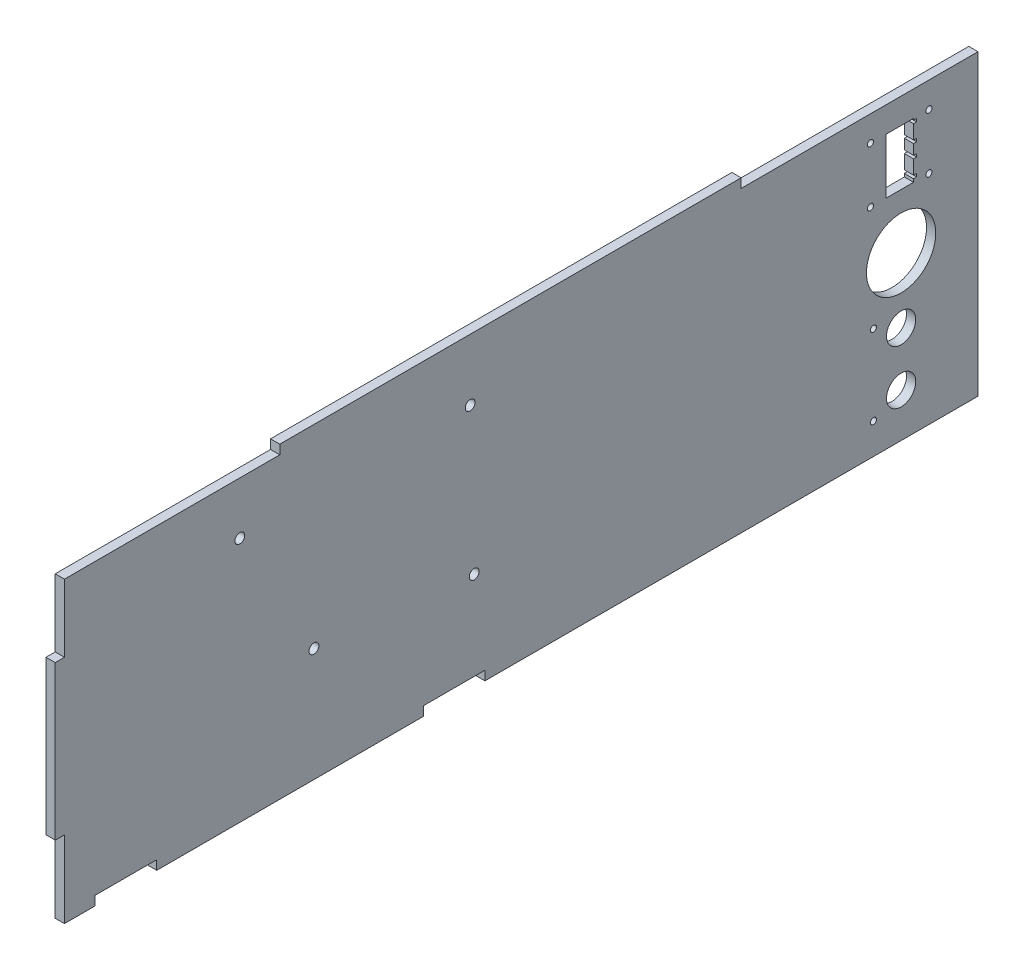
from build123d import *

# Parameters (mm, degrees)
ESQUISSE1_R        = 1
ESQUISSE1_R_2      = 4.75
ESQUISSE1_R_3      = 1.6
ESQUISSE1_R_4      = 11.265
BOSS_EXTRU_1_DEPTH = 3


with BuildPart() as part:
    # Esquisse1 → Boss.-Extru.1 (new body)
    with BuildSketch(Plane(origin=(3, 0, 0), x_dir=(0, 0, -1), z_dir=(1, 0, 0))):
        Polygon((-199.626758929, -26.84585796), (-189.626758929, -26.84585796), (-189.626758929, -23.84585796), (-169.626758929, -23.84585796), (-169.626758929, -26.84585796), (-82.926758929, -26.84585796), (-82.926758929, -23.84585796), (-62.926758929, -23.84585796), (-62.926758929, -26.84585796), (97.373241071, -26.84585796), (97.373241071, 70.15414204), (20.373241071, 70.15414204), (20.373241071, 73.15414204), (-129.626758929, 73.15414204), (-129.626758929, 70.15414204), (-199.626758929, 70.15414204), (-199.626758929, 48.15414204), (-202.626758929, 48.15414204), (-202.626758929, -1.84585796), (-199.626758929, -1.84585796), align=None)
        with Locations(Location((63.373241071, -16.84585796, 0), (0, 0, 180))):
            Circle(ESQUISSE1_R, mode=Mode.SUBTRACT)
        with Locations(Location((72.373241071, 4.90414204, 0), (0, 0, 180))):
            Circle(ESQUISSE1_R_2, mode=Mode.SUBTRACT)
        with Locations(Location((-67.726758929, 53.15414204, 0), (0, 0, 180))):
            Circle(ESQUISSE1_R_3, mode=Mode.SUBTRACT)
        with Locations(Location((-118.526758929, 10.05414204, 0), (0, 0, 180))):
            Circle(ESQUISSE1_R_3, mode=Mode.SUBTRACT)
        with Locations(Location((-142.626758929, 53.15414204, 0), (0, 0, 180))):
            Circle(ESQUISSE1_R_3, mode=Mode.SUBTRACT)
        with Locations(Location((-66.426758929, 4.95414204, 0), (0, 0, 180))):
            Circle(ESQUISSE1_R_3, mode=Mode.SUBTRACT)
        with Locations(Location((72.373241071, -12.59585796, 0), (0, 0, 180))):
            Circle(ESQUISSE1_R_2, mode=Mode.SUBTRACT)
        with Locations(Location((63.373241071, 9.15414204, 0), (0, 0, 180))):
            Circle(ESQUISSE1_R, mode=Mode.SUBTRACT)
        with Locations(Location((62.423241071, 43.85414204, 0), (0, 0, 180))):
            Circle(ESQUISSE1_R, mode=Mode.SUBTRACT)
        with Locations(Location((62.423241071, 61.85414204, 0), (0, 0, 180))):
            Circle(ESQUISSE1_R, mode=Mode.SUBTRACT)
        with Locations((72.373241071, 25.996622543)):
            Circle(ESQUISSE1_R_4, mode=Mode.SUBTRACT)
        with Locations(Location((81.423241071, 43.85414204, 0), (0, 0, 180))):
            Circle(ESQUISSE1_R, mode=Mode.SUBTRACT)
        with Locations(Location((81.423241071, 61.85414204, 0), (0, 0, 180))):
            Circle(ESQUISSE1_R, mode=Mode.SUBTRACT)
        Polygon((77.423241071, 44.85414204), (76.423241071, 44.85414204), (76.423241071, 43.85414204), (67.423241071, 43.85414204), (67.423241071, 61.85414204), (76.423241071, 61.85414204), (76.423241071, 61.35414204), (77.423241071, 61.35414204), (77.423241071, 60.35414204), (76.423241071, 60.35414204), (76.423241071, 55.75414204), (77.423241071, 55.75414204), (77.423241071, 54.75414204), (76.423241071, 54.75414204), (76.423241071, 51.45414204), (77.423241071, 51.45414204), (77.423241071, 50.45414204), (76.423241071, 50.45414204), (76.423241071, 45.85414204), (77.423241071, 45.85414204), align=None, mode=Mode.SUBTRACT)
    extrude(amount=-BOSS_EXTRU_1_DEPTH)


solid = part.part
